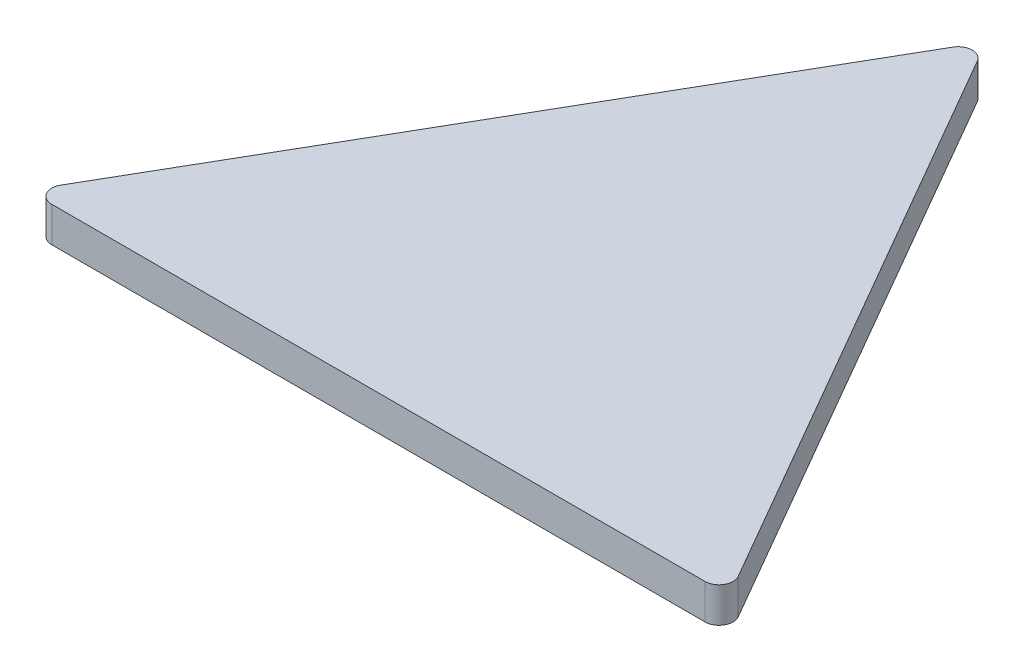
from build123d import *

# Parameters (mm, degrees)
BOSS_EXTRUDE1_DEPTH = 12.7
FILLET1_R           = 5.08


with BuildPart() as part:
    # Sketch1 → Boss-Extrude1 (new body)
    with BuildSketch(Plane(origin=(0, 0, 0), x_dir=(1, 0, 0), z_dir=(0, 1, 0))):
        Polygon((0, 146.646968374), (-127, -73.323484187), (127, -73.323484187), align=None)
    extrude(amount=BOSS_EXTRUDE1_DEPTH)

    # Fillet1
    fillet1_edges = [part.edges().sort_by_distance(p)[0] for p in [
        (127, 6.35, 73.323484187),
        (-127, 6.35, 73.323484187),
        (0, 6.35, -146.646968374),
    ]]
    fillet(fillet1_edges, radius=FILLET1_R)


solid = part.part
